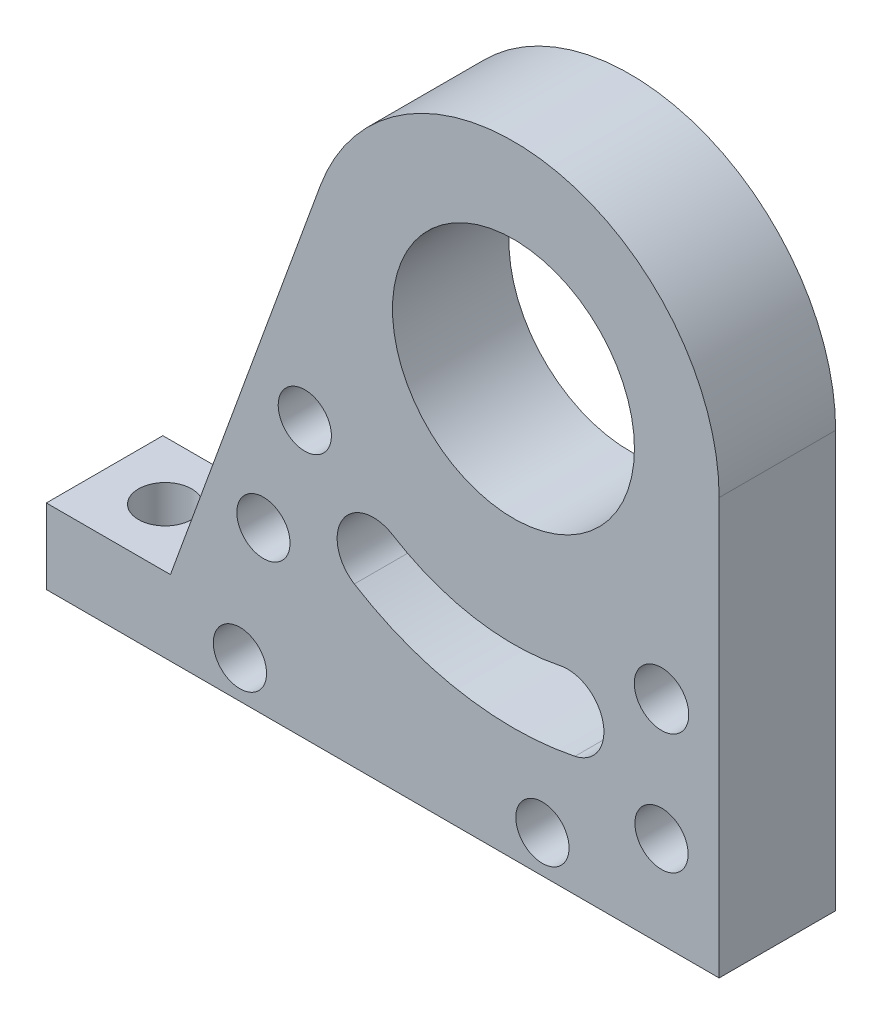
from build123d import *

# Parameters (mm, degrees)
SKETCH1_R           = 10
EXTRUDE_3_8_DEPTH   = 9.63
SKETCH2_R           = 2.2
SKETCH2_R_2         = 2.25
M4_THROUGH_DEPTH    = 9.63
CUT_EXTRUDE2_DEPTH  = 9.63
BOSS_EXTRUDE2_DEPTH = 9.63
SKETCH5_R           = 2.2
M5_DRILL_DEPTH      = 8
SKETCH7_R           = 2.2
M4_THROUGH2_DEPTH   = 9.63


with BuildPart() as part:
    # Sketch1 → 3/8 (new body)
    with BuildSketch(Plane.XY):
        with BuildLine():
            Line((17, 0), (17, -34.388204953))
            Line((17, -34.388204953), (-30.607305145, -34.388204953))
            Line((-30.607305145, -34.388204953), (-15.974774553, 5.814342437))
            ThreePointArc((-15.974774553, 5.814342437), (2.95201902, 16.741731801), (17, 0))
        make_face()
        Circle(SKETCH1_R, mode=Mode.SUBTRACT)
    extrude(amount=EXTRUDE_3_8_DEPTH)

    # Sketch2 → M4_through (cut)
    with BuildSketch(Plane.XY):
        with Locations(Location((12.2375, -26.800082425, 0), (0, 0, 180))):
            Circle(SKETCH2_R)
        with Locations(Location((12.2375, -16.800082425, 0), (0, 0, 180))):
            Circle(SKETCH2_R_2)
        with Locations(Location((-20.665656479, -20.998368188, 0), (0, 0, 180))):
            Circle(SKETCH2_R)
        with Locations(Location((-17.245455046, -11.60144198, 0), (0, 0, 180))):
            Circle(SKETCH2_R)
    extrude(amount=M4_THROUGH_DEPTH, mode=Mode.SUBTRACT)

    # Sketch4 → Cut-Extrude2 (cut)
    with BuildSketch(Plane.XY.offset(9.63)):
        with BuildLine():
            ThreePointArc((-9.994224888, -16.159067699), (-3.299315376, -18.711347307), (3.864772727, -18.602782904))
            ThreePointArc((3.864772727, -18.602782904), (7.412281511, -20.929837142), (5.085227273, -24.477345926))
            ThreePointArc((5.085227273, -24.477345926), (-4.341204442, -24.620193825), (-13.150295905, -21.261931182))
            ThreePointArc((-13.150295905, -21.261931182), (-14.123692138, -17.132463932), (-9.994224888, -16.159067699))
        make_face()
    extrude(amount=-CUT_EXTRUDE2_DEPTH, mode=Mode.SUBTRACT)

    # Sketch6 → Boss-Extrude2 (add)
    with BuildSketch(Plane.XY.offset(9.63)):
        Polygon((-30.607305145, -34.388204953), (-38.607305145, -34.388204953), (-38.607305145, -28.188204953), (-28.350689692, -28.188204953), align=None)
    extrude(amount=-BOSS_EXTRUDE2_DEPTH)

    # Sketch5 → M5_DRILL (cut)
    with BuildSketch(Plane.XZ.offset(34.388204953)):
        with Locations((-33.607305145, 4.815)):
            Circle(SKETCH5_R)
        with Locations((-8.607305145, 4.815)):
            Circle(SKETCH5_R)
    extrude(amount=-M5_DRILL_DEPTH, mode=Mode.SUBTRACT)

    # Sketch7 → M4_through2 (cut)
    with BuildSketch(Plane.XY.offset(9.63)):
        with Locations((-22.607305145, -31.288204953)):
            Circle(SKETCH7_R)
        with Locations((2.392694855, -31.288204953)):
            Circle(SKETCH7_R)
    extrude(amount=-M4_THROUGH2_DEPTH, mode=Mode.SUBTRACT)


solid = part.part
